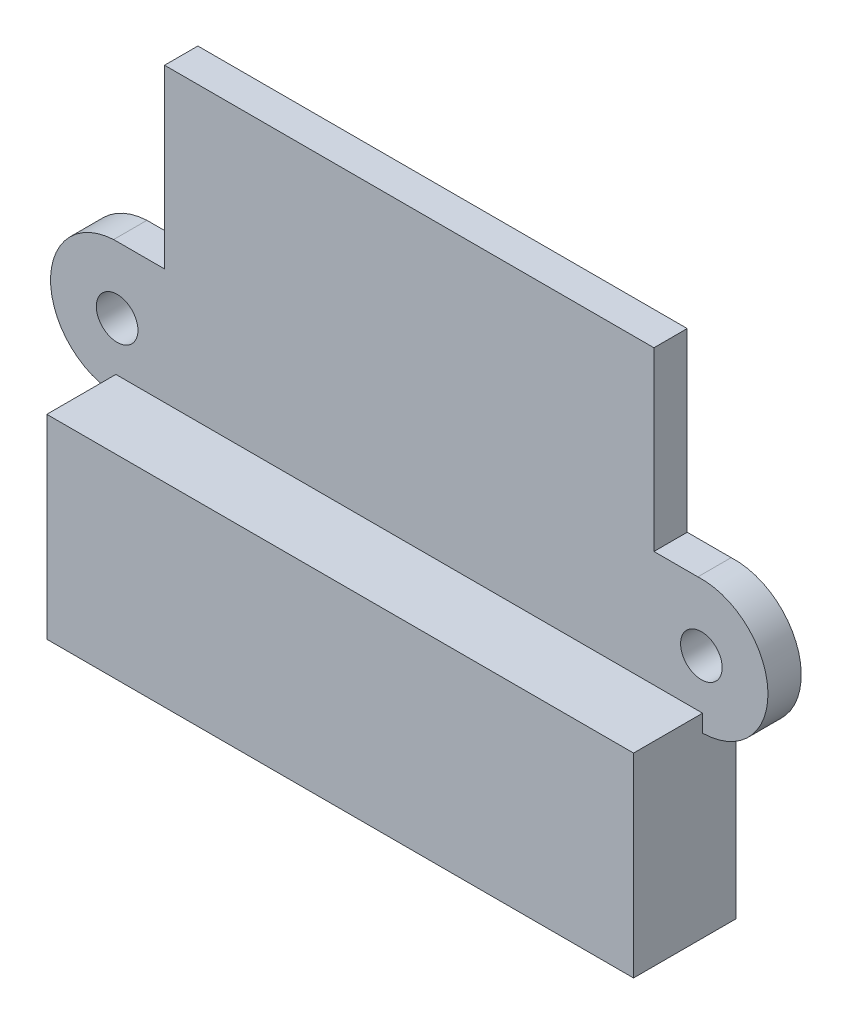
from build123d import *

# Parameters (mm, degrees)
SKETCH1_R           = 0.635000006
BOSS_EXTRUDE1_DEPTH = 1.016
SKETCH2_W           = 17.907
SKETCH2_H           = 5.945700236
BOSS_EXTRUDE2_DEPTH = 2.1082


with BuildPart() as part:
    # Sketch1 → Boss-Extrude1 (new body)
    with BuildSketch(Plane.XY):
        with BuildLine():
            Line((-7.4676, 7.430550118), (7.4676, 7.430550118))
            Line((7.4676, 7.430550118), (7.4676, 2.045750118))
            Line((7.4676, 2.045750118), (8.808625011, 2.045750118))
            ThreePointArc((8.808625011, 2.045750118), (10.946108081, 0.089005249), (8.9535, -2.015085385))
            Line((8.9535, -2.015085385), (8.9535, -7.430550118))
            Line((8.9535, -7.430550118), (-8.9535, -7.430550118))
            Line((-8.9535, -7.430550118), (-8.9535, -2.015085385))
            ThreePointArc((-8.9535, -2.015085385), (-10.947109486, -0.017801943), (-9.022174989, 2.045750118))
            Line((-9.022174989, 2.045750118), (-7.4676, 2.045750118))
            Line((-7.4676, 2.045750118), (-7.4676, 7.430550118))
        make_face()
        with Locations((-8.9154, 0.016557396)):
            Circle(SKETCH1_R, mode=Mode.SUBTRACT)
        with Locations((8.9154, 0.016557396)):
            Circle(SKETCH1_R, mode=Mode.SUBTRACT)
    extrude(amount=BOSS_EXTRUDE1_DEPTH)

    # Sketch2 → Boss-Extrude2 (add)
    with BuildSketch(Plane.XY.offset(1.016)):
        with Locations((0, -4.4577)):
            Rectangle(SKETCH2_W, SKETCH2_H)
    extrude(amount=BOSS_EXTRUDE2_DEPTH)


solid = part.part
